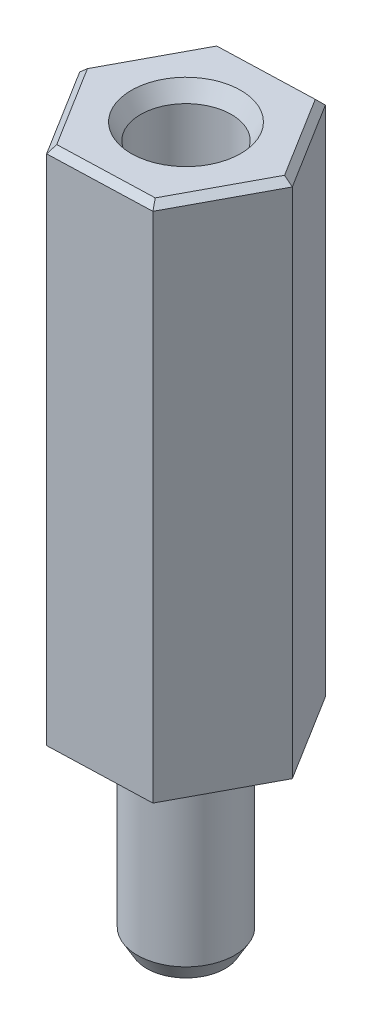
from build123d import *
from OCP.BRepFilletAPI import BRepFilletAPI_MakeChamfer

# Parameters (mm, degrees)
BOSS_EXTRUDE1_DEPTH = 16
SKETCH2_R           = 1.4
CUT_EXTRUDE1_DEPTH  = 10
SKETCH3_R           = 1.5
BOSS_EXTRUDE2_DEPTH = 6
CHAMFER1_SIZE       = 0.5
CHAMFER1_SIZE2      = 0.288675135
CHAMFER2_SIZE       = 0.2


with BuildPart() as part:
    # Sketch1 → Boss-Extrude1 (new body)
    with BuildSketch(Plane(origin=(0, 0, 0), x_dir=(1, 0, 0), z_dir=(0, 1, 0))):
        Polygon((1.497494138, 2.800150824), (-1.676254679, 2.696943378), (-3.173748817, -0.103207446), (-1.497494138, -2.800150824), (1.676254679, -2.696943378), (3.173748817, 0.103207446), align=None)
    extrude(amount=BOSS_EXTRUDE1_DEPTH)

    # Sketch2 → Cut-Extrude1 (cut)
    with BuildSketch(Plane(origin=(0, 16, 0), x_dir=(1, 0, 0), z_dir=(0, 1, 0))):
        with Locations(Location((0, 0, 0), (0, 0, 270))):
            Circle(SKETCH2_R)
    extrude(amount=-CUT_EXTRUDE1_DEPTH, mode=Mode.SUBTRACT)

    # Sketch3 → Boss-Extrude2 (add)
    with BuildSketch(Plane.XZ):
        with Locations(Location((0, 0, 0), (0, 0, 270))):
            Circle(SKETCH3_R)
    extrude(amount=BOSS_EXTRUDE2_DEPTH)

    # Chamfer1: one chamfer whose edges measure the first distance from different faces: ONE call of the kernel's chamfer builder (chamfer() names one face for all edges)
    chamfer1_edges_1 = [part.edges().sort_by_distance(p)[0] for p in [
        (0, 16, -1.4),
    ]]
    chamfer1_side_1 = [part.faces().sort_by_distance(p)[0] for p in [
        (0, 11, -1.4),
    ]]
    chamfer1_edges_2 = [part.edges().sort_by_distance(p)[0] for p in [
        (0, -6, 1.5),
    ]]
    chamfer1_side_2 = [part.faces().sort_by_distance(p)[0] for p in [
        (0, -3, 1.5),
    ]]
    chamfer1 = BRepFilletAPI_MakeChamfer(part.part.solid().wrapped)
    for e in chamfer1_edges_1:
        chamfer1.Add(CHAMFER1_SIZE, CHAMFER1_SIZE2, e.wrapped, chamfer1_side_1[0].wrapped)  # the first distance lies on this face
    for e in chamfer1_edges_2:
        chamfer1.Add(CHAMFER1_SIZE, CHAMFER1_SIZE2, e.wrapped, chamfer1_side_2[0].wrapped)  # the first distance lies on this face
    add(Compound.cast(chamfer1.Shape()), mode=Mode.REPLACE)

    # Chamfer2
    chamfer2_edges = [part.edges().sort_by_distance(p)[0] for p in [
        (-2.425001748, 16, -1.296867966),
        (-2.335621478, 16, 1.451679135),
        (0.08938027, 16, 2.748547101),
        (2.425001748, 16, 1.296867966),
        (2.335621478, 16, -1.451679135),
        (-0.08938027, 16, -2.748547101),
    ]]
    chamfer(chamfer2_edges, length=CHAMFER2_SIZE)


solid = part.part
